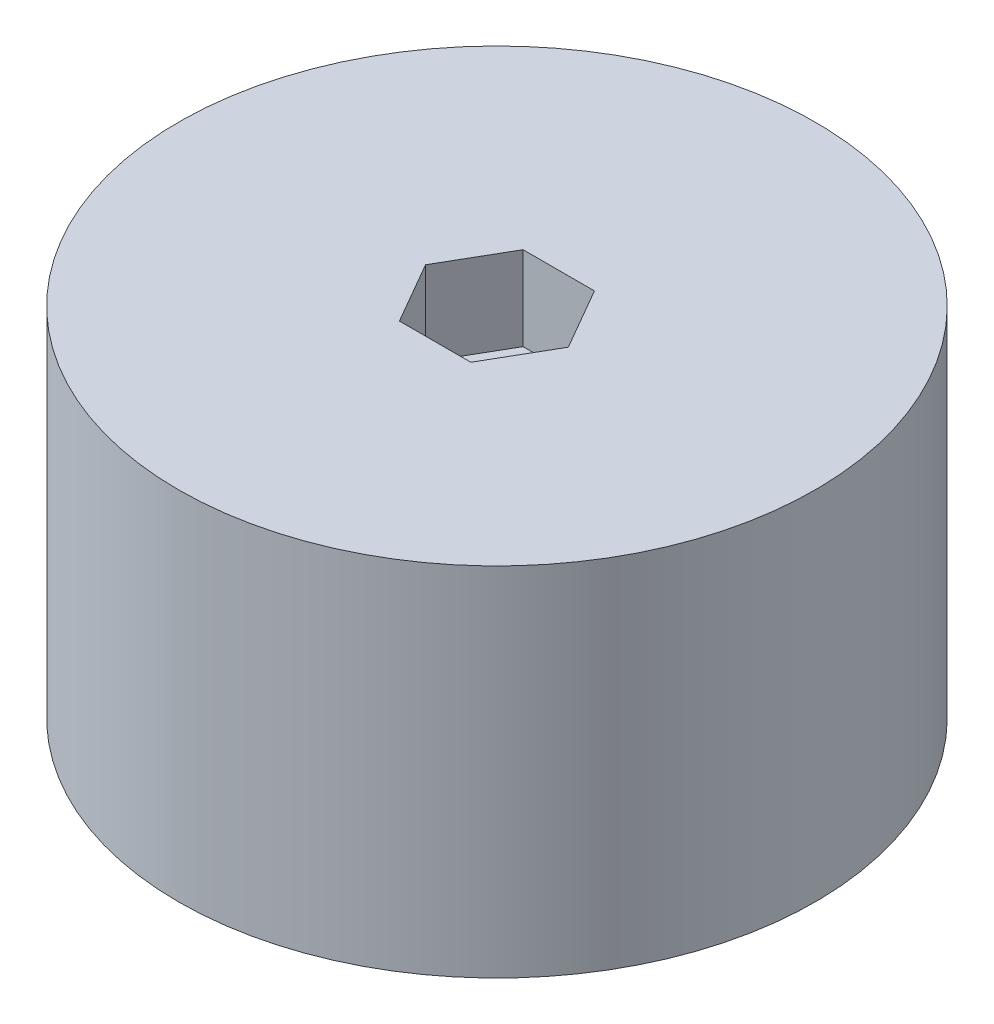
from build123d import *

# Parameters (mm, degrees)
SKETCH1_R           = 22.75
SKETCH1_R_2         = 3
BOSS_EXTRUDE1_DEPTH = 25.5
CUT_EXTRUDE1_DEPTH  = 6


with BuildPart() as part:
    # Sketch1 → Boss-Extrude1 (new body)
    with BuildSketch(Plane(origin=(0, 0, 0), x_dir=(1, 0, 0), z_dir=(0, 1, 0))):
        with Locations(Location((0, 0, 0), (0, 0, 270))):
            Circle(SKETCH1_R)
        with Locations(Location((0, 0, 0), (0, 0, 270))):
            Circle(SKETCH1_R_2, mode=Mode.SUBTRACT)
    extrude(amount=BOSS_EXTRUDE1_DEPTH)

    # Sketch2 → Cut-Extrude1 (cut)
    with BuildSketch(Plane(origin=(0, 25.5, 0), x_dir=(1, 0, 0), z_dir=(0, 1, 0))):
        Polygon((5.1, 0), (2.55, 4.416729559), (-2.55, 4.416729559), (-5.1, 0), (-2.55, -4.416729559), (2.55, -4.416729559), align=None)
    extrude(amount=-CUT_EXTRUDE1_DEPTH, mode=Mode.SUBTRACT)


solid = part.part
